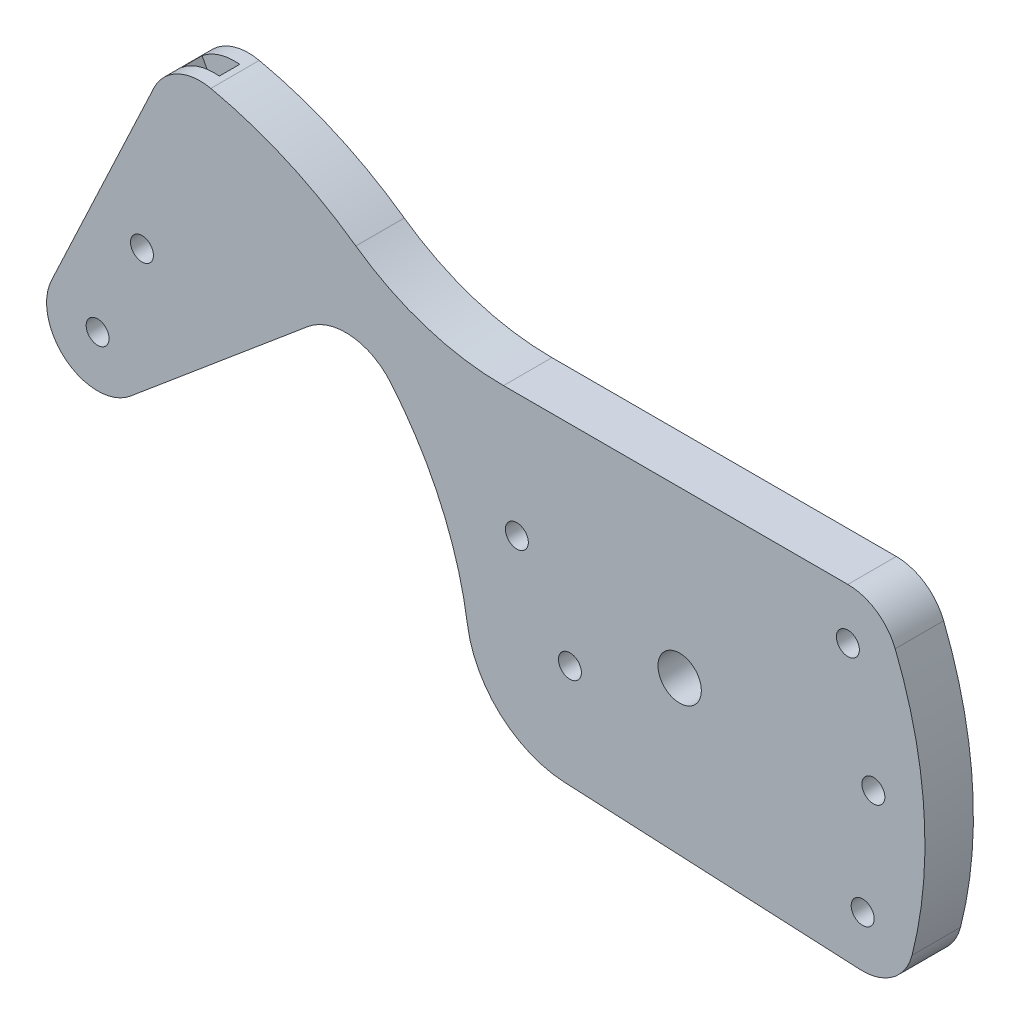
from build123d import *

# Parameters (mm, degrees)
SKETCH1_R           = 4.25
SKETCH1_R_2         = 2.25
BOSS_EXTRUDE1_DEPTH = 4.75
CUT_EXTRUDE1_DEPTH  = 2


with BuildPart() as part:
    # Sketch1 → Boss-Extrude1 (new, symmetric)
    with BuildSketch(Plane.XY):
        with BuildLine():
            Line((-22.500230832, -28.983987123), (35.398437983, -31.788291003))
            ThreePointArc((35.398437983, -31.788291003), (41.825152283, -29.842482755), (45.572267137, -24.270413418))
            ThreePointArc((45.572267137, -24.270413418), (47.922199842, 1.185089324), (42.266415188, 26.115330067))
            ThreePointArc((42.266415188, 26.115330067), (38.587871094, 30.681102), (32.982217728, 32.4))
            Line((32.982217728, 32.4), (-34.53815208, 32.4))
            ThreePointArc((-34.53815208, 32.4), (-49.730929753, 34.764094355), (-63.487021029, 41.632819737))
            ThreePointArc((-63.487021029, 41.632819737), (-77.067258547, 49.344582351), (-91.918742124, 54.174444589))
            ThreePointArc((-91.918742124, 54.174444589), (-98.466295495, 53.366674665), (-103.085929893, 48.656905518))
            Line((-103.085929893, 48.656905518), (-123.167077545, 5.955614534))
            ThreePointArc((-123.167077545, 5.955614534), (-120.218280198, -6.2236308), (-107.689906175, -5.960444431))
            Line((-107.689906175, -5.960444431), (-72.864818345, 23.261273923))
            ThreePointArc((-72.864818345, 23.261273923), (-64.470178387, 25.908093735), (-56.662687309, 21.843771132))
            ThreePointArc((-56.662687309, 21.843771132), (-46.809939593, 6.135423294), (-41.608278072, -11.662653759))
            ThreePointArc((-41.608278072, -11.662653759), (-35.156858245, -23.745961099), (-22.500230832, -28.983987123))
        make_face()
        Circle(SKETCH1_R, mode=Mode.SUBTRACT)
        with Locations((35.882217728, -21.8)):
            Circle(SKETCH1_R_2, mode=Mode.SUBTRACT)
        with Locations((-21.517782272, -8.7)):
            Circle(SKETCH1_R_2, mode=Mode.SUBTRACT)
        with Locations((37.982217728, -0.1)):
            Circle(SKETCH1_R_2, mode=Mode.SUBTRACT)
        with Locations((32.982217728, 22.4)):
            Circle(SKETCH1_R_2, mode=Mode.SUBTRACT)
        with Locations((-31.917782272, 8.2)):
            Circle(SKETCH1_R_2, mode=Mode.SUBTRACT)
        with Locations((-105.417782272, 20.2)):
            Circle(SKETCH1_R_2, mode=Mode.SUBTRACT)
        with Locations((-114.117782272, 1.7)):
            Circle(SKETCH1_R_2, mode=Mode.SUBTRACT)
    extrude(amount=BOSS_EXTRUDE1_DEPTH, both=True)

    # Sketch2 → Cut-Extrude1 (cut, symmetric)
    with BuildSketch(Plane.XY):
        with BuildLine():
            Line((-78.227129447, 18.761760655), (-92.084556702, 44.987885053))
            Line((-92.084556702, 44.987885053), (-93.002217677, 54.347646176))
            ThreePointArc((-93.002217677, 54.347646176), (-96.914482214, 53.978242129), (-100.382341665, 52.129939126))
            Line((-100.382341665, 52.129939126), (-95.988712538, 43.814696915))
            Line((-95.988712538, 43.814696915), (-92.369017313, 6.895307763))
            Line((-92.369017313, 6.895307763), (-78.227129447, 18.761760655))
        make_face()
    extrude(amount=CUT_EXTRUDE1_DEPTH, both=True, mode=Mode.SUBTRACT)


solid = part.part
